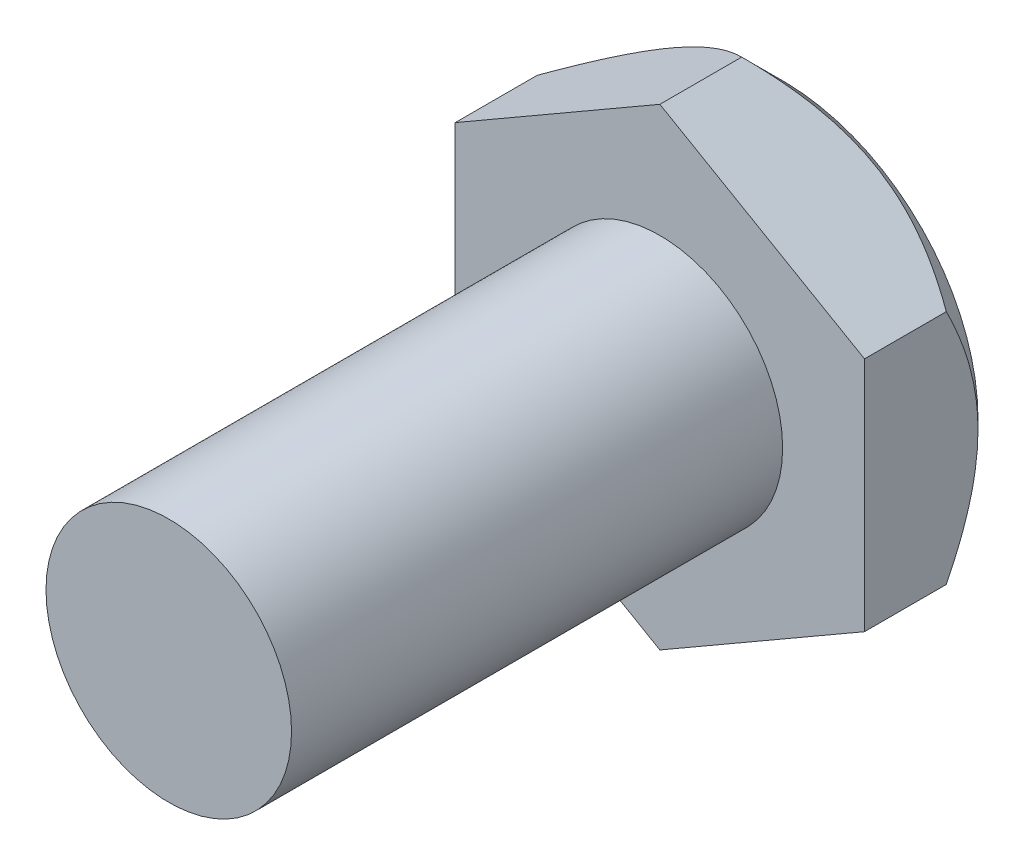
from build123d import *

# Parameters (mm, degrees)
BOSS_EXTRUDE1_DEPTH = 3
SKETCH2_R           = 3
BOSS_EXTRUDE2_DEPTH = 12


with BuildPart() as part:
    # Sketch1 → Boss-Extrude1 (new body)
    with BuildSketch(Plane.XY):
        Polygon((0, -5.773502692), (5, -2.886751346), (5, 2.886751346), (0, 5.773502692), (-5, 2.886751346), (-5, -2.886751346), align=None)
    extrude(amount=BOSS_EXTRUDE1_DEPTH)

    # Sketch2 → Boss-Extrude2 (add)
    with BuildSketch(Plane.XY.offset(3)):
        Circle(SKETCH2_R)
    extrude(amount=BOSS_EXTRUDE2_DEPTH)

    # Sketch3 → Cut-Revolve1 (revolve, cut)
    with BuildSketch(Plane(origin=(0, 0, 0), x_dir=(0, 0, -1), z_dir=(1, 0, 0)), mode=Mode.PRIVATE) as cut_revolve1_sk:
        Polygon((-1, 5.773502692), (0, 5.773502692), (0, 4.773502692), align=None)
    revolve(cut_revolve1_sk.sketch.rotate(Axis((0, 0, 11.168529758), (0, 0, -1)), 90), axis=Axis((0, 0, 11.168529758), (0, 0, -1)), mode=Mode.SUBTRACT)


solid = part.part
